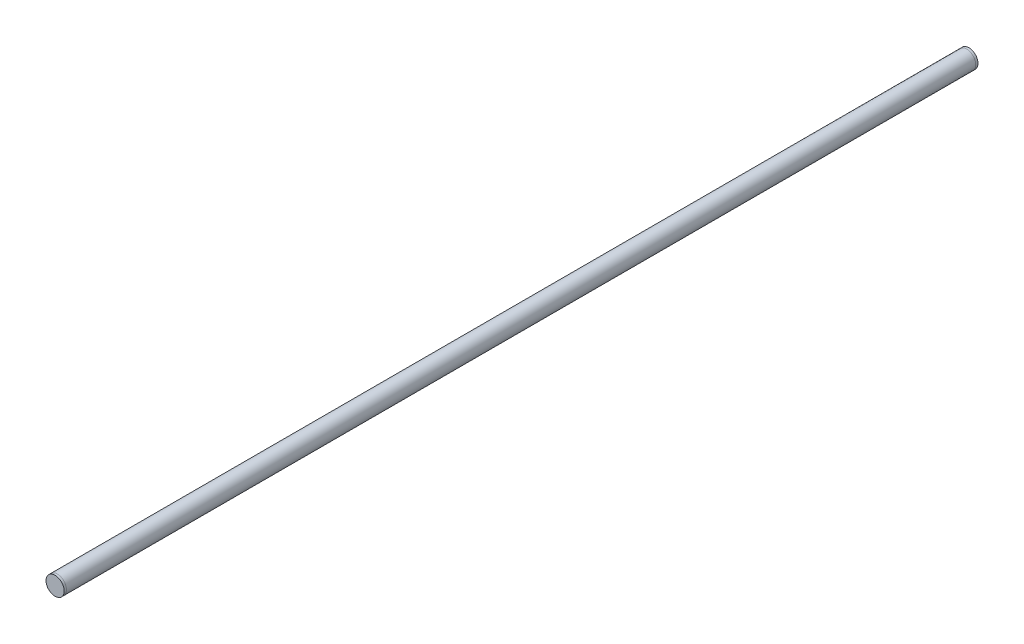
from build123d import *

# Parameters (mm, degrees)
SKETCH_1_R      = 4
EXTRUDE_1_DEPTH = 400
SKETCH_4_R      = 4
EXTRUDE_2_DEPTH = 1
SKETCH_5_R      = 4
EXTRUDE_3_DEPTH = 1


with BuildPart() as part:
    # 草图1 → 拉伸1 (new body)
    with BuildSketch(Plane.XY):
        Circle(SKETCH_1_R)
    extrude(amount=EXTRUDE_1_DEPTH)


with BuildPart() as body_2:
    # 草图4 → 拉伸2 (new body)
    with BuildSketch(Plane(origin=(0, 0, 0), x_dir=(-1, 0, 0), z_dir=(0, 0, -1))):
        Circle(SKETCH_4_R)
    extrude(amount=EXTRUDE_2_DEPTH)


with BuildPart() as body_3:
    # 草图5 → 拉伸3 (new body)
    with BuildSketch(Plane.XY.offset(400)):
        Circle(SKETCH_5_R)
    extrude(amount=EXTRUDE_3_DEPTH)


solid = Compound([part.part, body_2.part, body_3.part])
